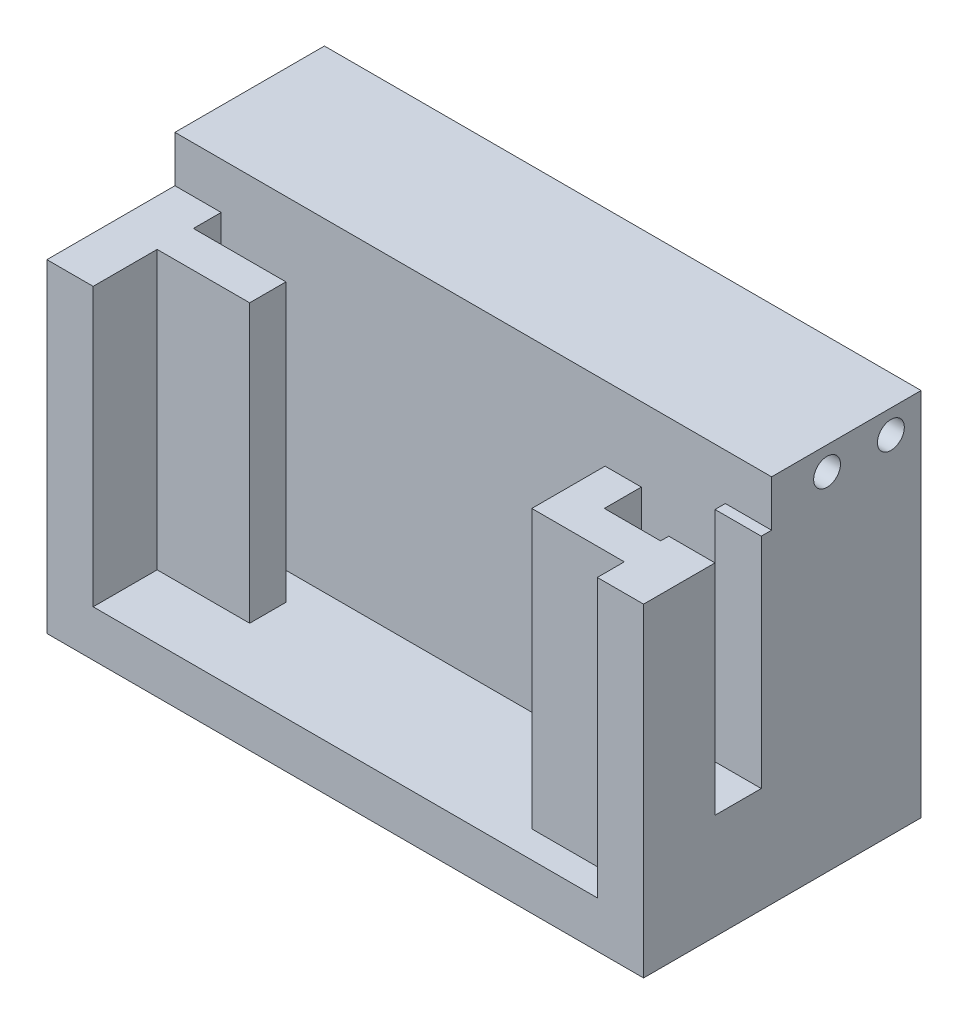
from build123d import *

# Parameters (mm, degrees)
ESQUISSE1_W             = 54.5
ESQUISSE1_H             = 30
BOSS_EXTRU_8_DEPTH      = 5
ESQUISSE7_W             = 30
ESQUISSE7_H             = 30
BOSS_EXTRU_9_DEPTH      = 5
ESQUISSE8_W             = 30
ESQUISSE8_H             = 30
BOSS_EXTRU_10_DEPTH     = 5
ESQUISSE9_W             = 64.5
ESQUISSE9_H             = 30
BOSS_EXTRU_11_DEPTH     = 5
ESQUISSE10_W            = 5
ESQUISSE10_H            = 30
BOSS_EXTRU_12_DEPTH     = 55
ESQUISSE11_W            = 64.5
ESQUISSE11_H            = 16.16204781
BOSS_EXTRU_13_DEPTH     = 5
ESQUISSE13_W            = 3.918976095
ESQUISSE13_H            = 30
BOSS_EXTRU_14_DEPTH     = 10
ESQUISSE16_W            = 3.9189761
ESQUISSE16_H            = 30
BOSS_EXTRU_15_DEPTH     = 10
ESQUISSE17_W            = 3.9189761
ESQUISSE17_H            = 30
BOSS_EXTRU_16_DEPTH     = 4
ESQUISSE20_W            = 5
ESQUISSE20_H            = 23.625106292
ENL_V_MAT_EXTRU_2_DEPTH = 7
ESQUISSE21_R            = 1.45
ENL_V_MAT_EXTRU_3_DEPTH = 7
ENL_V_START             = -7
ESQUISSE22_R            = 1.45
ENL_V_MAT_EXTRU_4_DEPTH = 7


with BuildPart() as part:
    # Esquisse1 → Boss.-Extru.8 (new body)
    with BuildSketch(Plane.XY):
        with Locations((-8.335450003, 5.161172161)):
            Rectangle(ESQUISSE1_W, ESQUISSE1_H)
    extrude(amount=BOSS_EXTRU_8_DEPTH)

    # Esquisse7 → Boss.-Extru.9 (add)
    with BuildSketch(Plane.ZY.offset(35.585450003)):
        with Locations((15, 5.161172161)):
            Rectangle(ESQUISSE7_W, ESQUISSE7_H)
    extrude(amount=BOSS_EXTRU_9_DEPTH)

    # Esquisse8 → Boss.-Extru.10 (add)
    with BuildSketch(Plane(origin=(18.914549997, 0, 0), x_dir=(0, 0, -1), z_dir=(1, 0, 0))):
        with Locations((-15, 5.161172161)):
            Rectangle(ESQUISSE8_W, ESQUISSE8_H)
    extrude(amount=BOSS_EXTRU_10_DEPTH)

    # Esquisse9 → Boss.-Extru.11 (add)
    with BuildSketch(Plane.XZ.offset(9.838827839)):
        with Locations((-8.335450003, 15)):
            Rectangle(ESQUISSE9_W, ESQUISSE9_H)
    extrude(amount=BOSS_EXTRU_11_DEPTH)

    # Esquisse10 → Boss.-Extru.12 (add)
    with BuildSketch(Plane(origin=(-35.585450003, 0, 0), x_dir=(0, 0, -1), z_dir=(1, 0, 0))):
        with Locations((-13.66204781, 5.161172161)):
            Rectangle(ESQUISSE10_W, ESQUISSE10_H)
    extrude(amount=BOSS_EXTRU_12_DEPTH)

    # Esquisse11 → Boss.-Extru.13 (add)
    with BuildSketch(Plane(origin=(0, 20.161172161, 0), x_dir=(1, 0, 0), z_dir=(0, 1, 0))):
        with Locations((-8.335450003, -8.081023905)):
            Rectangle(ESQUISSE11_W, ESQUISSE11_H)
    extrude(amount=BOSS_EXTRU_13_DEPTH)

    # Esquisse13 → Boss.-Extru.14 (add)
    with BuildSketch(Plane(origin=(-35.585450003, 0, 0), x_dir=(0, 0, -1), z_dir=(1, 0, 0))):
        with Locations((-21.121535857, 5.161172161)):
            Rectangle(ESQUISSE13_W, ESQUISSE13_H)
    extrude(amount=BOSS_EXTRU_14_DEPTH)

    # Esquisse16 → Boss.-Extru.15 (add)
    with BuildSketch(Plane.ZY.offset(-18.914549997)):
        with Locations((25.12153586, 5.161172161)):
            Rectangle(ESQUISSE16_W, ESQUISSE16_H)
    extrude(amount=BOSS_EXTRU_15_DEPTH)

    # Esquisse17 → Boss.-Extru.16 (add)
    with BuildSketch(Plane(origin=(0, 0, 23.16204781), x_dir=(-1, 0, 0), z_dir=(0, 0, -1))):
        with Locations((-10.874038047, 5.161172161)):
            Rectangle(ESQUISSE17_W, ESQUISSE17_H)
    extrude(amount=BOSS_EXTRU_16_DEPTH)

    # Esquisse20 → Enlèv. mat.-Extru.2 (cut)
    with BuildSketch(Plane.ZY.offset(-18.914549997)):
        with Locations((19.77668855, 8.348619015)):
            Rectangle(ESQUISSE20_W, ESQUISSE20_H)
    extrude(amount=-ENL_V_MAT_EXTRU_2_DEPTH, mode=Mode.SUBTRACT)

    # Esquisse21 → Enlèv. mat.-Extru.3 (cut)
    with BuildSketch(Plane.ZY.offset(40.585450003)):
        with Locations(Location((3.265574061, 22.632321906, 0), (0, 0, 270))):
            Circle(ESQUISSE21_R)
        with Locations(Location((10.165574061, 22.632321906, 0), (0, 0, 270))):
            Circle(ESQUISSE21_R)
    extrude(amount=-ENL_V_MAT_EXTRU_3_DEPTH, mode=Mode.SUBTRACT)

    # Esquisse22 → Enlèv. mat.-Extru.4 (cut)
    with BuildSketch(Plane(origin=(23.914549997, 0, 0), x_dir=(0, 0, -1), z_dir=(1, 0, 0)).offset(ENL_V_START)):
        with Locations(Location((-3.26557406, 22.632321901, 0), (0, 0, 269.999999963))):
            Circle(ESQUISSE22_R)
        with Locations(Location((-10.16557406, 22.632321901, 0), (0, 0, 269.999999963))):
            Circle(ESQUISSE22_R)
    extrude(amount=ENL_V_MAT_EXTRU_4_DEPTH, mode=Mode.SUBTRACT)


solid = part.part
